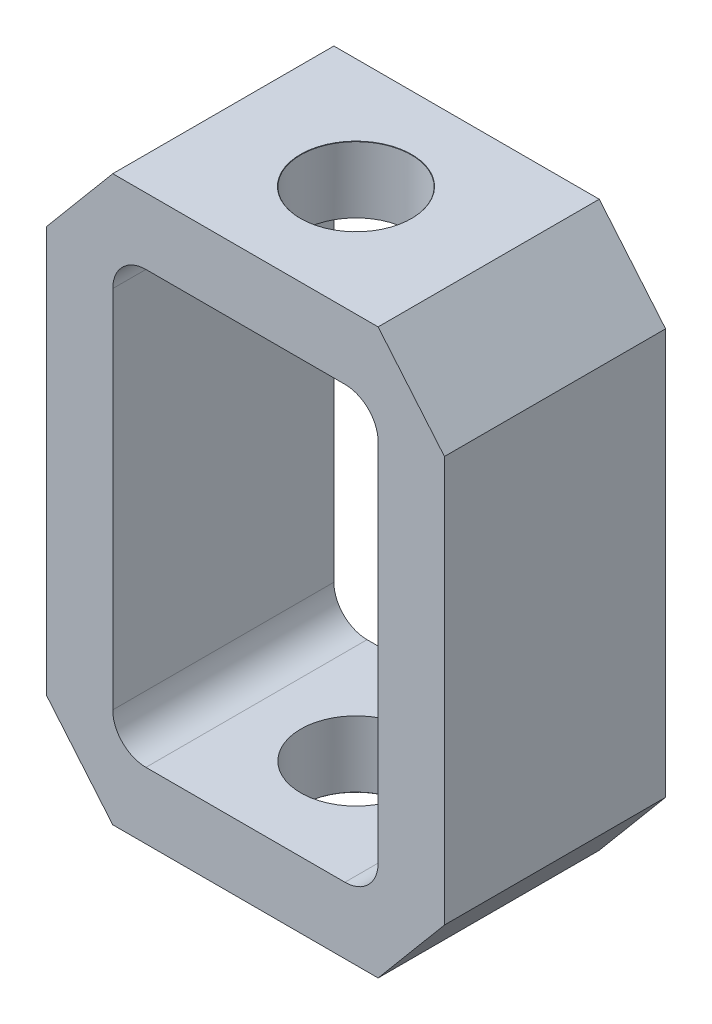
from build123d import *

# Parameters (mm, degrees)
SKETCH1_W                        = 24
SKETCH1_H                        = 39
BOSS_EXTRUDE1_DEPTH              = 10
F_10_0MM_DOWEL_HOLE1_D           = 10
F_10_0MM_DOWEL_HOLE1_DEPTH       = 24.5
F_10_0MM_DOWEL_HOLE1_CSINK_D     = 10.05
F_10_0MM_DOWEL_HOLE1_CSINK_ANGLE = 90
F_10_0MM_DOWEL_HOLE1_TIP         = 3.004303095
F_10_0MM_DOWEL_HOLE2_D           = 10
F_10_0MM_DOWEL_HOLE2_DEPTH       = 24.5
F_10_0MM_DOWEL_HOLE2_CSINK_D     = 10.05
F_10_0MM_DOWEL_HOLE2_CSINK_ANGLE = 90
F_10_0MM_DOWEL_HOLE2_TIP         = 3.004303095
FILLET1_R                        = 3


with BuildPart() as part:
    # Sketch1 → Boss-Extrude1 (new, symmetric)
    with BuildSketch(Plane.XY):
        Polygon((-18, -18.349478444), (-18, 18.349478444), (-12, 25.5), (12, 25.5), (18, 18.349478444), (18, -18.349478444), (12, -25.5), (-12, -25.5), align=None)
        Rectangle(SKETCH1_W, SKETCH1_H, mode=Mode.SUBTRACT)
    extrude(amount=BOSS_EXTRUDE1_DEPTH, both=True)

    # Ø10.0mm Dowel Hole1
    with Locations(Plane(origin=(0, 25.5, 0), x_dir=(1, 0, 0), z_dir=(0, 1, 0))):
        with Locations((0, 0)):
            CounterSinkHole(F_10_0MM_DOWEL_HOLE1_D / 2, F_10_0MM_DOWEL_HOLE1_CSINK_D / 2, depth=F_10_0MM_DOWEL_HOLE1_DEPTH, counter_sink_angle=F_10_0MM_DOWEL_HOLE1_CSINK_ANGLE)
            with Locations((0, 0, -(F_10_0MM_DOWEL_HOLE1_DEPTH + F_10_0MM_DOWEL_HOLE1_TIP / 2))):  # 118° drill point
                Cone(0, F_10_0MM_DOWEL_HOLE1_D / 2, F_10_0MM_DOWEL_HOLE1_TIP, mode=Mode.SUBTRACT)

    # Ø10.0mm Dowel Hole2
    with Locations(Plane(origin=(0, -25.5, 0), x_dir=(-1, 0, 0), z_dir=(0, -1, 0))):
        with Locations((0, 0)):
            CounterSinkHole(F_10_0MM_DOWEL_HOLE2_D / 2, F_10_0MM_DOWEL_HOLE2_CSINK_D / 2, depth=F_10_0MM_DOWEL_HOLE2_DEPTH, counter_sink_angle=F_10_0MM_DOWEL_HOLE2_CSINK_ANGLE)
            with Locations((0, 0, -(F_10_0MM_DOWEL_HOLE2_DEPTH + F_10_0MM_DOWEL_HOLE2_TIP / 2))):  # 118° drill point
                Cone(0, F_10_0MM_DOWEL_HOLE2_D / 2, F_10_0MM_DOWEL_HOLE2_TIP, mode=Mode.SUBTRACT)

    # Fillet1
    fillet1_edges = [part.edges().sort_by_distance(p)[0] for p in [
        (12, -19.5, 0),
        (12, 19.5, 0),
        (-12, 19.5, 0),
        (-12, -19.5, 0),
    ]]
    fillet(fillet1_edges, radius=FILLET1_R)


solid = part.part
